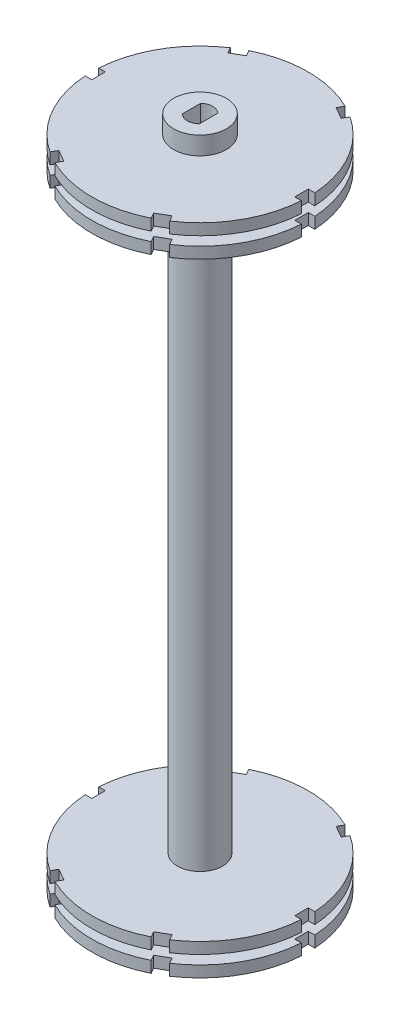
from build123d import *

# Parameters (mm, degrees)
BOSS_EXTRUDE1_DEPTH     = 6.5
SKETCH2_R               = 24
BOSS_EXTRUDE2_DEPTH     = 2.5
CUT_EXTRUDE1_DEPTH      = 8
SKETCH4_W               = 3
SKETCH4_H               = 3
CUT_EXTRUDE2_DEPTH      = 10
SKETCH5_R               = 5
BOSS_EXTRUDE3_DEPTH     = 140
CUT_EXTRUDE3_DEPTH      = 15
MIRROR6_COPY_1_SKETCH_R = 24
MIRROR6_COPY_1_DEPTH    = 2.5
MIRROR6_COPY_2_SKETCH_W = 3
MIRROR6_COPY_2_SKETCH_H = 3
MIRROR6_COPY_2_DEPTH    = 10


with BuildPart() as part:
    # Sketch1 → Boss-Extrude1 (new body)
    with BuildSketch(Plane(origin=(0, 0, 0), x_dir=(1, 0, 0), z_dir=(0, 1, 0))):
        with BuildLine():
            ThreePointArc((-1.9, -2.05669638), (-2.8, 0), (-1.9, 2.05669638))
            Line((-1.9, 2.05669638), (-1.9, 5.532856405))
            ThreePointArc((-1.9, 5.532856405), (-5.85, 0), (-1.9, -5.532856405))
            Line((-1.9, -5.532856405), (-1.9, -2.05669638))
        make_face()
        with BuildLine():
            ThreePointArc((-1.9, 2.05669638), (0, 2.8), (1.9, 2.05669638))
            Line((1.9, 2.05669638), (1.9, 5.532856405))
            ThreePointArc((1.9, 5.532856405), (0, 5.85), (-1.9, 5.532856405))
            Line((-1.9, 5.532856405), (-1.9, 2.05669638))
        make_face()
        with BuildLine():
            Line((1.9, 5.532856405), (1.9, 2.05669638))
            ThreePointArc((1.9, 2.05669638), (2.565151068, 1.122497216), (2.8, 0))
            ThreePointArc((2.8, 0), (2.565151068, -1.122497216), (1.9, -2.05669638))
            Line((1.9, -2.05669638), (1.9, -5.532856405))
            ThreePointArc((1.9, -5.532856405), (4.761171074, -3.399080758), (5.85, 0))
            ThreePointArc((5.85, 0), (4.761171074, 3.399080758), (1.9, 5.532856405))
        make_face()
        with BuildLine():
            Line((1.9, -5.532856405), (1.9, -2.05669638))
            ThreePointArc((1.9, -2.05669638), (0, -2.8), (-1.9, -2.05669638))
            Line((-1.9, -2.05669638), (-1.9, -5.532856405))
            ThreePointArc((-1.9, -5.532856405), (0, -5.85), (1.9, -5.532856405))
        make_face()
        with BuildLine():
            Line((-1.9, -2.05669638), (-1.9, 2.05669638))
            ThreePointArc((-1.9, 2.05669638), (-2.8, 0), (-1.9, -2.05669638))
        make_face()
        with BuildLine():
            ThreePointArc((2.8, 0), (2.565151068, 1.122497216), (1.9, 2.05669638))
            Line((1.9, 2.05669638), (1.9, -2.05669638))
            ThreePointArc((1.9, -2.05669638), (2.565151068, -1.122497216), (2.8, 0))
        make_face()
    boss_extrude1 = extrude(amount=BOSS_EXTRUDE1_DEPTH)

    # Sketch2 → Boss-Extrude2 (add)
    with BuildSketch(Plane(origin=(0, 6.5, 0), x_dir=(1, 0, 0), z_dir=(0, 1, 0))):
        with Locations(Location((0, 0, 0), (0, 0, 270))):
            Circle(SKETCH2_R)
    boss_extrude2 = extrude(amount=-BOSS_EXTRUDE2_DEPTH)

    # Sketch3 → Cut-Extrude1 (cut)
    with BuildSketch(Plane.XZ.offset(-4)):
        with BuildLine():
            Line((-1.9, 2.05669638), (-1.9, -2.05669638))
            ThreePointArc((-1.9, -2.05669638), (0, -2.8), (1.9, -2.05669638))
            Line((1.9, -2.05669638), (1.9, 2.05669638))
            ThreePointArc((1.9, 2.05669638), (0, 2.8), (-1.9, 2.05669638))
        make_face()
    cut_extrude1 = extrude(amount=-CUT_EXTRUDE1_DEPTH, mode=Mode.SUBTRACT)

    # Sketch4 → Cut-Extrude2 (cut)
    with BuildSketch(Plane(origin=(0, 6.5, 0), x_dir=(1, 0, 0), z_dir=(0, 1, 0))):
        Polygon((12.549038106, -18.735571585), (14.049038106, -21.333647797), (11.450961894, -22.833647797), (9.950961894, -20.235571585), align=None)
        with Locations((24, 0)):
            Rectangle(SKETCH4_W, SKETCH4_H)
        Polygon((-9.950961894, -20.235571585), (-11.450961894, -22.833647797), (-14.049038106, -21.333647797), (-12.549038106, -18.735571585), align=None)
        with Locations((-24, 0)):
            Rectangle(SKETCH4_W, SKETCH4_H)
        Polygon((-12.549038106, 18.735571585), (-14.049038106, 21.333647797), (-11.450961894, 22.833647797), (-9.950961894, 20.235571585), align=None)
        Polygon((9.950961894, 20.235571585), (11.450961894, 22.833647797), (14.049038106, 21.333647797), (12.549038106, 18.735571585), align=None)
    cut_extrude2 = extrude(amount=-CUT_EXTRUDE2_DEPTH, mode=Mode.SUBTRACT)

    # Sketch5 → Boss-Extrude3 (add)
    with BuildSketch(Plane(origin=(0, 6.5, 0), x_dir=(1, 0, 0), z_dir=(0, 1, 0))):
        with Locations(Location((0, 0, 0), (0, 0, 270))):
            Circle(SKETCH5_R)
    extrude(amount=BOSS_EXTRUDE3_DEPTH)

    # Mirror1: Boss-Extrude2 across plane
    add(boss_extrude2.mirror(Plane.ZX.offset(76.5)))

    # Mirror2: Boss-Extrude1 across plane
    add(boss_extrude1.mirror(Plane.ZX.offset(76.5)))

    # Mirror3: Boss-Extrude2, Cut-Extrude1, Cut-Extrude2 across plane
    add(boss_extrude2.mirror(Plane.ZX.offset(7.5)))
    add(cut_extrude1.mirror(Plane.ZX.offset(7.5)), mode=Mode.SUBTRACT)
    add(cut_extrude2.mirror(Plane.ZX.offset(7.5)), mode=Mode.SUBTRACT)

    # Sketch6 → Cut-Extrude3 (cut)
    with BuildSketch(Plane.XZ.offset(-11)):
        with BuildLine():
            Line((-1.9, 2.05669638), (-1.9, -2.05669638))
            ThreePointArc((-1.9, -2.05669638), (0, -2.8), (1.9, -2.05669638))
            Line((1.9, -2.05669638), (1.9, 2.05669638))
            ThreePointArc((1.9, 2.05669638), (0, 2.8), (-1.9, 2.05669638))
        make_face()
    extrude(amount=-CUT_EXTRUDE3_DEPTH, mode=Mode.SUBTRACT)

    # Mirror5: Cut-Extrude2 across plane
    add(cut_extrude2.mirror(Plane.ZX.offset(76.5)), mode=Mode.SUBTRACT)

    # Mirror6 copy 1 sketch → Mirror6 copy 1 (add)
    with BuildSketch(Plane(origin=(0, 144.5, 0), x_dir=(1, 0, 0), z_dir=(0, 1, 0))):
        with Locations(Location((0, 0, 0), (0, 0, 270))):
            Circle(MIRROR6_COPY_1_SKETCH_R)
    extrude(amount=-MIRROR6_COPY_1_DEPTH)

    # Mirror6 copy 2 sketch → Mirror6 copy 2 (cut)
    with BuildSketch(Plane(origin=(0, 144.5, 0), x_dir=(1, 0, 0), z_dir=(0, 1, 0))):
        Polygon((12.549038106, -18.735571585), (14.049038106, -21.333647797), (11.450961894, -22.833647797), (9.950961894, -20.235571585), align=None)
        with Locations((24, 0)):
            Rectangle(MIRROR6_COPY_2_SKETCH_W, MIRROR6_COPY_2_SKETCH_H)
        Polygon((-9.950961894, -20.235571585), (-11.450961894, -22.833647797), (-14.049038106, -21.333647797), (-12.549038106, -18.735571585), align=None)
        with Locations((-24, 0)):
            Rectangle(MIRROR6_COPY_2_SKETCH_W, MIRROR6_COPY_2_SKETCH_H)
        Polygon((-12.549038106, 18.735571585), (-14.049038106, 21.333647797), (-11.450961894, 22.833647797), (-9.950961894, 20.235571585), align=None)
        Polygon((9.950961894, 20.235571585), (11.450961894, 22.833647797), (14.049038106, 21.333647797), (12.549038106, 18.735571585), align=None)
    extrude(amount=-MIRROR6_COPY_2_DEPTH, mode=Mode.SUBTRACT)


solid = part.part
